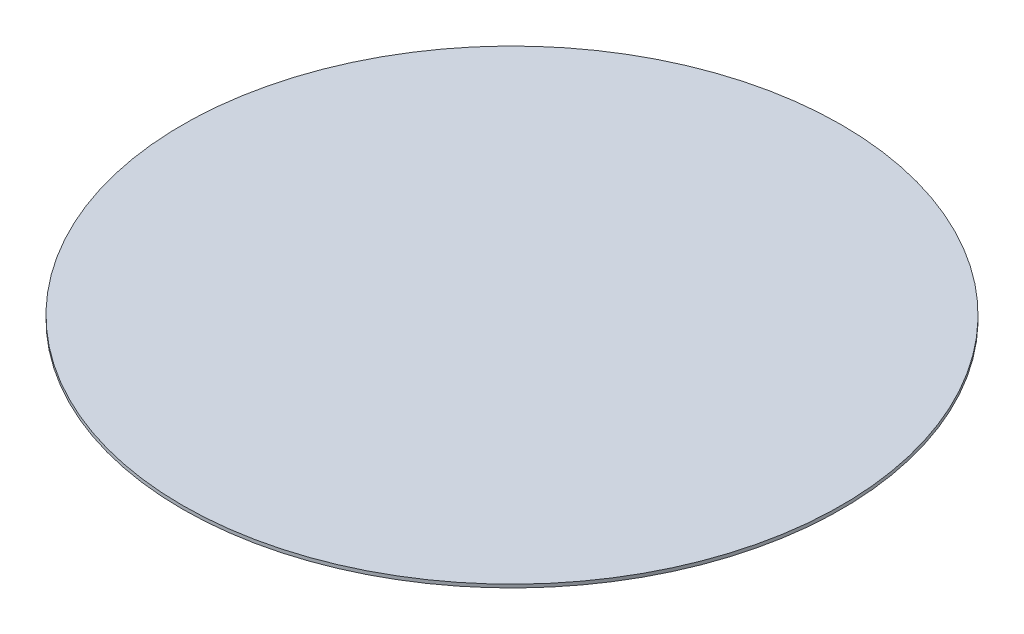
from build123d import *

# Parameters (mm, degrees)
SKETCH1_R           = 100
BOSS_EXTRUDE1_DEPTH = 1


with BuildPart() as part:
    # Sketch1 → Boss-Extrude1 (new body)
    with BuildSketch(Plane(origin=(0, 0, 0), x_dir=(1, 0, 0), z_dir=(0, 1, 0))):
        with Locations(Location((0, 0, 0), (0, 0, 270))):
            Circle(SKETCH1_R)
    extrude(amount=BOSS_EXTRUDE1_DEPTH)


solid = part.part
